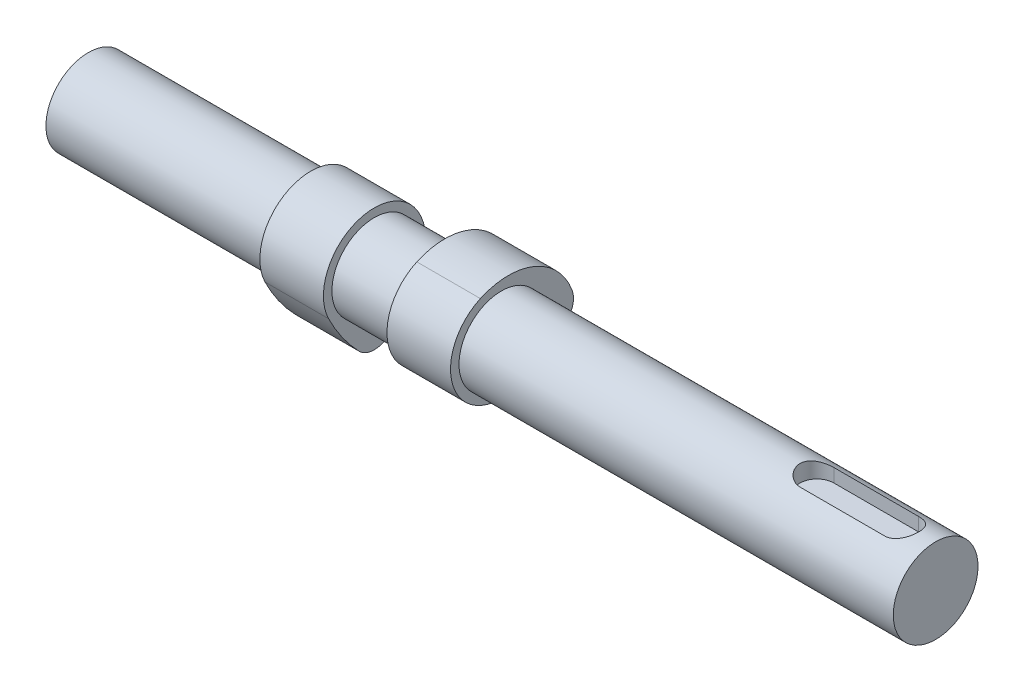
from build123d import *

# Parameters (mm, degrees)
BOSS_EXTRUDE1_DEPTH      = 125
BOSS_EXTRUDE1_DEPTH_BACK = 75
SKETCH1_R                = 10
BOSS_EXTRUDE2_START      = 15
BOSS_EXTRUDE2_DEPTH      = 7.5
BODY_MOVE_COPY1_ANGLE    = 90
CUT_EXTRUDE1_DEPTH       = 4


with BuildPart() as part:
    # Sketch1 → Boss-Extrude1 (new, two sides: drawn at the far end of the back side and taken through both)
    with BuildSketch(Plane(origin=(0, 0, 0), x_dir=(0, 0, -1), z_dir=(1, 0, 0)).offset(-BOSS_EXTRUDE1_DEPTH_BACK)):
        Circle(SKETCH1_R)
    extrude(amount=BOSS_EXTRUDE1_DEPTH + BOSS_EXTRUDE1_DEPTH_BACK)

    # Sketch3 → Cut-Extrude1 (cut)
    with BuildSketch(Plane(origin=(0, 10, 0), x_dir=(1, 0, 0), z_dir=(0, 1, 0))):
        with BuildLine():
            Line((97, 4), (117, 4))
            ThreePointArc((117, 4), (121, 0), (117, -4))
            Line((117, -4), (97, -4))
            ThreePointArc((97, -4), (93, 0), (97, 4))
        make_face()
    extrude(amount=-CUT_EXTRUDE1_DEPTH, mode=Mode.SUBTRACT)


with BuildPart() as body_2:
    # Sketch2 → Boss-Extrude2 (new, symmetric)
    with BuildSketch(Plane(origin=(0, 0, 0), x_dir=(0, 0, -1), z_dir=(1, 0, 0)).offset(BOSS_EXTRUDE2_START)):
        with BuildLine():
            ThreePointArc((-4.950818385, 10.931120589), (-10.855235073, -5.115063196), (5.27814522, -10.776881879))
            ThreePointArc((5.27814522, -10.776881879), (10.675009162, -7.586625818), (15.507108825, -3.59229396))
            ThreePointArc((15.507108825, -3.59229396), (16.895326586, -1.149524968), (16.746983201, 1.656230392))
            ThreePointArc((16.746983201, 1.656230392), (7.939134659, 11.068540296), (-4.950818385, 10.931120589))
        make_face()
    extrude(amount=BOSS_EXTRUDE2_DEPTH, both=True)


with BuildPart() as body_3:
    # Mirror4: mirrored copy
    add(body_2.part.mirror(Plane(origin=(0, 0, 0), x_dir=(0, 0, 1), z_dir=(1, 0, 0))))


with BuildPart() as body_3_1:
    # Body-Move/Copy1: moved
    add(body_3.part.rotate(Axis((0, 0, 0), (-1, 0, 0)), BODY_MOVE_COPY1_ANGLE))


solid = Compound([part.part, body_2.part, body_3_1.part])
